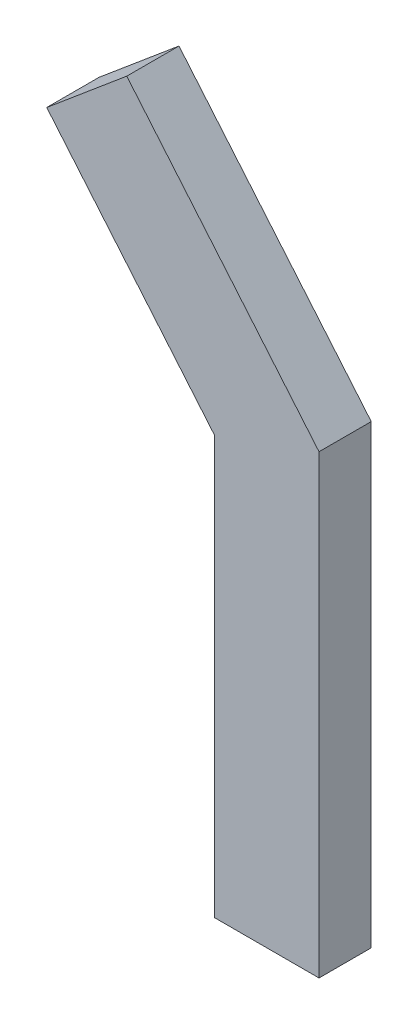
from build123d import *

# Parameters (mm, degrees)
EXTRUDE_1_DEPTH = 0.1


with BuildPart() as part:
    # 草圖1 → 填料-伸長1 (new body)
    with BuildSketch(Plane.XY):
        Polygon((0, 0), (0, 0.8), (-0.321393805, 1.183022222), (-0.168184916, 1.311579743), (0.2, 0.872794047), (0.2, 0), align=None)
    extrude(amount=EXTRUDE_1_DEPTH)


solid = part.part
